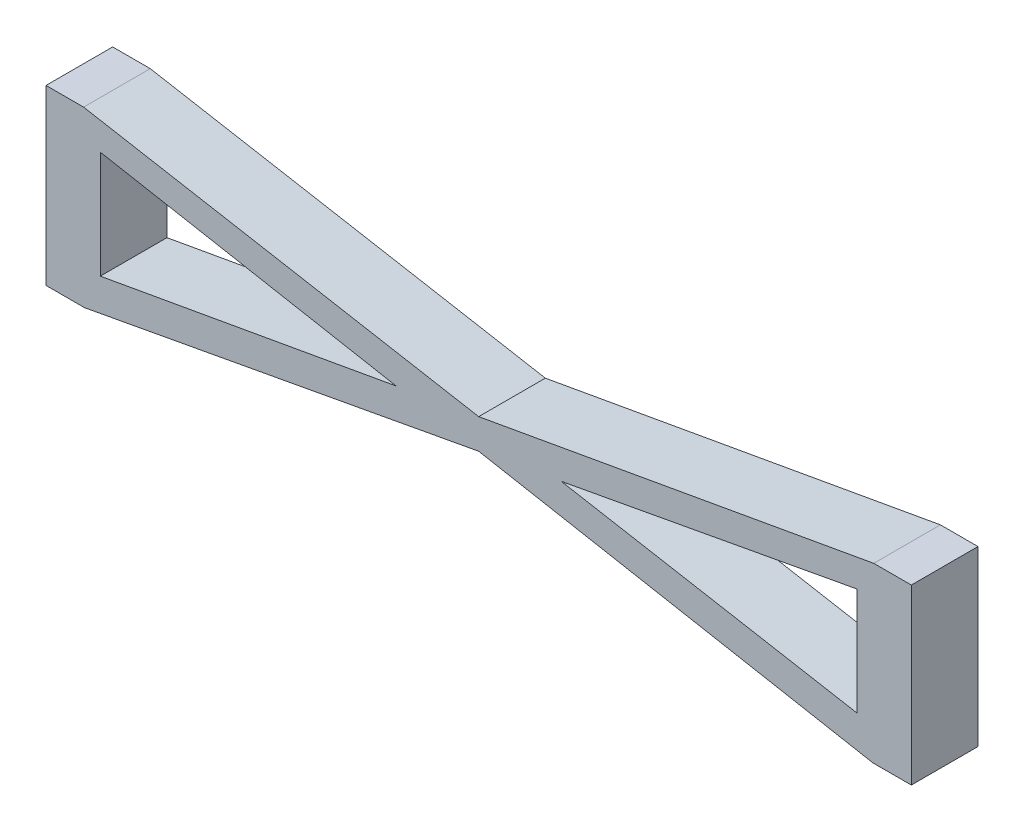
from build123d import *

# Parameters (mm, degrees)
BOSS_EXTRUDE1_DEPTH = 19.0272625


with BuildPart() as part:
    # Sketch1 → Boss-Extrude1 (new body)
    with BuildSketch(Plane.XY):
        Polygon((0, 0), (10.985406775, 0), (123.4989795, 20.769522906), (236.012552225, 0), (246.997959, 0), (246.997959, 49.45), (236.267497729, 49.45), (123.4989795, 29.326227234), (10.730461271, 49.45), (0, 49.45), align=None)
        Polygon((15.5, 40.705671267), (99.929892015, 25.120275357), (15.5, 10.053588411), align=None, mode=Mode.SUBTRACT)
        Polygon((231.497959, 40.705671267), (147.068066985, 25.120275357), (231.497959, 10.053588411), align=None, mode=Mode.SUBTRACT)
    extrude(amount=BOSS_EXTRUDE1_DEPTH)


solid = part.part
